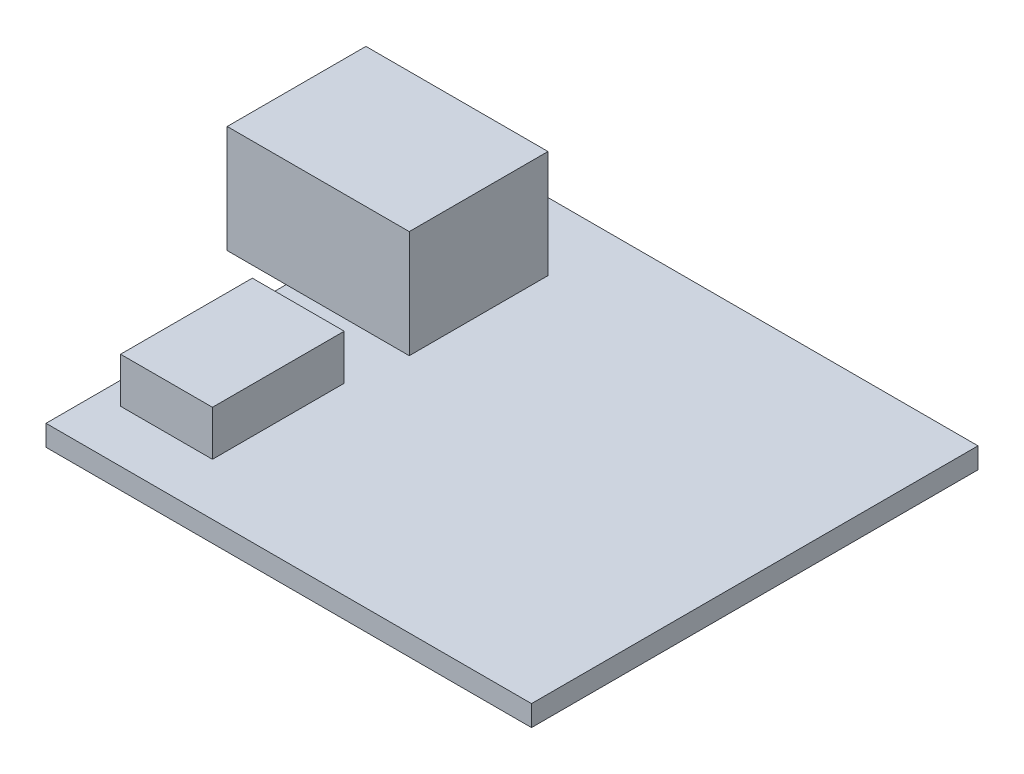
from build123d import *

# Parameters (mm, degrees)
SKETCH1_W           = 28
SKETCH1_H           = 25.75
BOSS_EXTRUDE1_DEPTH = 1.2
SKETCH2_W           = 10.5
SKETCH2_H           = 8
BOSS_EXTRUDE2_DEPTH = 6.2
SKETCH3_W           = 5.3
SKETCH3_H           = 7.6
BOSS_EXTRUDE3_DEPTH = 2.6


with BuildPart() as part:
    # Sketch1 → Boss-Extrude1 (new body)
    with BuildSketch(Plane(origin=(0, 0, 0), x_dir=(1, 0, 0), z_dir=(0, 1, 0))):
        Rectangle(SKETCH1_W, SKETCH1_H)
    extrude(amount=BOSS_EXTRUDE1_DEPTH)

    # Sketch2 → Boss-Extrude2 (add)
    with BuildSketch(Plane(origin=(0, 1.2, 0), x_dir=(1, 0, 0), z_dir=(0, 1, 0))):
        with Locations((-12.15, 4.975)):
            Rectangle(SKETCH2_W, SKETCH2_H)
    extrude(amount=BOSS_EXTRUDE2_DEPTH)

    # Sketch3 → Boss-Extrude3 (add)
    with BuildSketch(Plane(origin=(0, 1.2, 0), x_dir=(1, 0, 0), z_dir=(0, 1, 0))):
        with Locations((-10.05, -6.075)):
            Rectangle(SKETCH3_W, SKETCH3_H)
    extrude(amount=BOSS_EXTRUDE3_DEPTH)


solid = part.part
